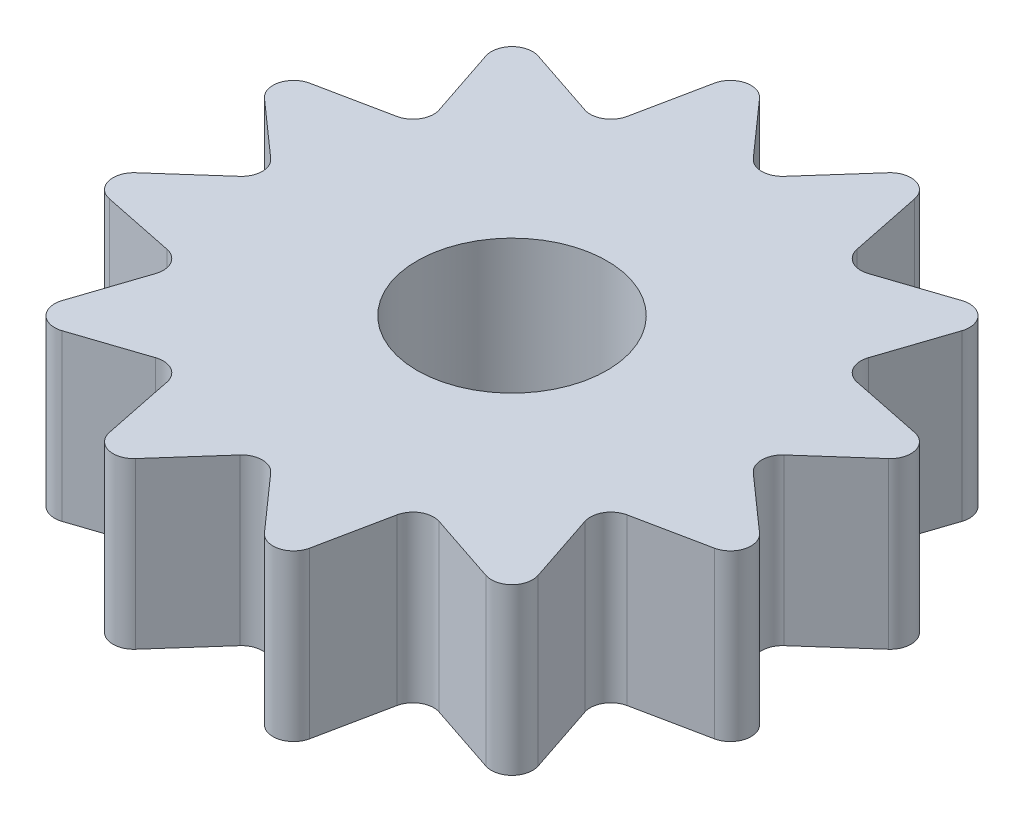
from build123d import *

# Parameters (mm, degrees)
SKETCH2_R           = 2.3
BOSS_EXTRUDE1_DEPTH = 4


with BuildPart() as part:
    # Sketch2 → Boss-Extrude1 (new body)
    with BuildSketch(Plane(origin=(0, 0, 0), x_dir=(1, 0, 0), z_dir=(0, 1, 0))):
        with BuildLine():
            Line((-2.784735434, -5.571506186), (-2.425826245, -7.32540615))
            ThreePointArc((-2.425826245, -7.32540615), (-2.065386908, -7.708128878), (-1.561875921, -7.556900941))
            Line((-1.561875921, -7.556900941), (-0.374101464, -6.217433611))
            ThreePointArc((-0.374101464, -6.217433611), (0, -6.049168588), (0.374101464, -6.217433611))
            Line((0.374101464, -6.217433611), (1.561875921, -7.556900941))
            ThreePointArc((1.561875921, -7.556900941), (2.065386908, -7.708128878), (2.425826245, -7.32540615))
            Line((2.425826245, -7.32540615), (2.784735434, -5.571506186))
            ThreePointArc((2.784735434, -5.571506186), (3.024584294, -5.238733669), (3.432698177, -5.197404722))
            Line((3.432698177, -5.197404722), (5.131074696, -5.763530228))
            ThreePointArc((5.131074696, -5.763530228), (5.64274197, -5.64274197), (5.763530228, -5.131074696))
            Line((5.763530228, -5.131074696), (5.197404722, -3.432698177))
            ThreePointArc((5.197404722, -3.432698177), (5.238733669, -3.024584294), (5.571506186, -2.784735434))
            Line((5.571506186, -2.784735434), (7.32540615, -2.425826245))
            ThreePointArc((7.32540615, -2.425826245), (7.708128878, -2.065386908), (7.556900941, -1.561875921))
            Line((7.556900941, -1.561875921), (6.217433611, -0.374101464))
            ThreePointArc((6.217433611, -0.374101464), (6.049168588, 0), (6.217433611, 0.374101464))
            Line((6.217433611, 0.374101464), (7.556900941, 1.561875921))
            ThreePointArc((7.556900941, 1.561875921), (7.708128878, 2.065386908), (7.32540615, 2.425826245))
            Line((7.32540615, 2.425826245), (5.571506186, 2.784735434))
            ThreePointArc((5.571506186, 2.784735434), (5.238733669, 3.024584294), (5.197404722, 3.432698177))
            Line((5.197404722, 3.432698177), (5.763530228, 5.131074696))
            ThreePointArc((5.763530228, 5.131074696), (5.64274197, 5.64274197), (5.131074696, 5.763530228))
            Line((5.131074696, 5.763530228), (3.432698177, 5.197404722))
            ThreePointArc((3.432698177, 5.197404722), (3.024584294, 5.238733669), (2.784735434, 5.571506186))
            Line((2.784735434, 5.571506186), (2.425826245, 7.32540615))
            ThreePointArc((2.425826245, 7.32540615), (2.065386908, 7.708128878), (1.561875921, 7.556900941))
            Line((1.561875921, 7.556900941), (0.374101464, 6.217433611))
            ThreePointArc((0.374101464, 6.217433611), (0, 6.049168588), (-0.374101464, 6.217433611))
            Line((-0.374101464, 6.217433611), (-1.561875921, 7.556900941))
            ThreePointArc((-1.561875921, 7.556900941), (-2.065386908, 7.708128878), (-2.425826245, 7.32540615))
            Line((-2.425826245, 7.32540615), (-2.784735434, 5.571506186))
            ThreePointArc((-2.784735434, 5.571506186), (-3.024584294, 5.238733669), (-3.432698177, 5.197404722))
            Line((-3.432698177, 5.197404722), (-5.131074696, 5.763530228))
            ThreePointArc((-5.131074696, 5.763530228), (-5.64274197, 5.64274197), (-5.763530228, 5.131074696))
            Line((-5.763530228, 5.131074696), (-5.197404722, 3.432698177))
            ThreePointArc((-5.197404722, 3.432698177), (-5.238733669, 3.024584294), (-5.571506186, 2.784735434))
            Line((-5.571506186, 2.784735434), (-7.32540615, 2.425826245))
            ThreePointArc((-7.32540615, 2.425826245), (-7.708128878, 2.065386908), (-7.556900941, 1.561875921))
            Line((-7.556900941, 1.561875921), (-6.217433611, 0.374101464))
            ThreePointArc((-6.217433611, 0.374101464), (-6.049168588, 0), (-6.217433611, -0.374101464))
            Line((-6.217433611, -0.374101464), (-7.556900941, -1.561875921))
            ThreePointArc((-7.556900941, -1.561875921), (-7.708128878, -2.065386908), (-7.32540615, -2.425826245))
            Line((-7.32540615, -2.425826245), (-5.571506186, -2.784735434))
            ThreePointArc((-5.571506186, -2.784735434), (-5.238733669, -3.024584294), (-5.197404722, -3.432698177))
            Line((-5.197404722, -3.432698177), (-5.763530228, -5.131074696))
            ThreePointArc((-5.763530228, -5.131074696), (-5.64274197, -5.64274197), (-5.131074696, -5.763530228))
            Line((-5.131074696, -5.763530228), (-3.432698177, -5.197404722))
            ThreePointArc((-3.432698177, -5.197404722), (-3.024584294, -5.238733669), (-2.784735434, -5.571506186))
        make_face()
        with Locations(Location((0, 0, 0), (0, 0, 270))):
            Circle(SKETCH2_R, mode=Mode.SUBTRACT)
    extrude(amount=-BOSS_EXTRUDE1_DEPTH)


solid = part.part
